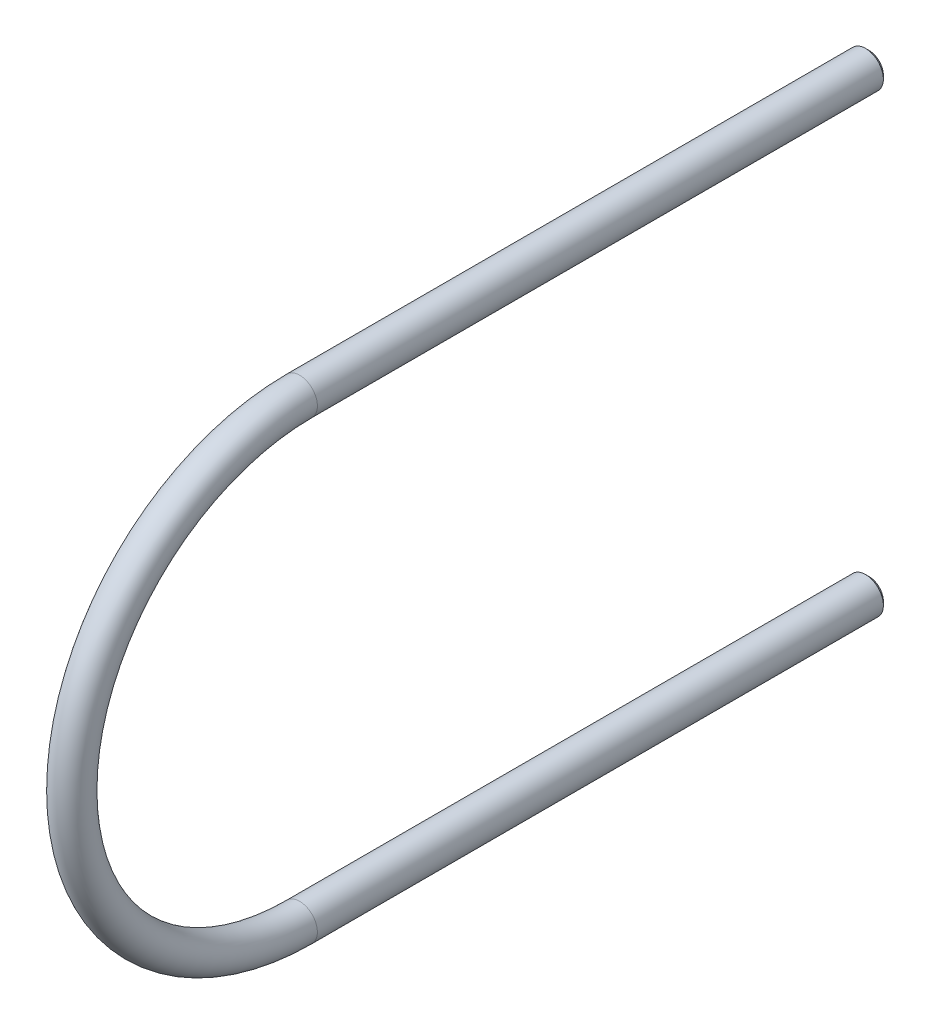
from build123d import *

# Parameters (mm, degrees)
SKETCH1_R           = 2.5
REVOLVE1_ANGLE      = 180
SKETCH1_2_R         = 2.5
BOSS_EXTRUDE1_DEPTH = 80
SKETCH2_R           = 2.5
BOSS_EXTRUDE2_DEPTH = 80
CHAMFER1_SIZE       = 0.5


with BuildPart() as part:
    # Sketch1 → Revolve1 (revolve)
    with BuildSketch(Plane.XY):
        with Locations((0, 32)):
            Circle(SKETCH1_R)
    revolve(axis=Axis((0, 0, 0), (1, 0, 0)), revolution_arc=REVOLVE1_ANGLE)

    # Sketch1<2> → Boss-Extrude1 (add)
    with BuildSketch(Plane.XY):
        with Locations((0, 32)):
            Circle(SKETCH1_2_R)
    extrude(amount=-BOSS_EXTRUDE1_DEPTH)

    # Sketch2 → Boss-Extrude2 (add)
    with BuildSketch(Plane(origin=(0, 0, 0), x_dir=(-1, 0, 0), z_dir=(0, 0, -1))):
        with Locations((0, -32)):
            Circle(SKETCH2_R)
    extrude(amount=BOSS_EXTRUDE2_DEPTH)

    # Chamfer1
    chamfer1_edges = [part.edges().sort_by_distance(p)[0] for p in [
        (2.5, -32, -80),
        (-2.5, 32, -80),
    ]]
    chamfer(chamfer1_edges, length=CHAMFER1_SIZE)


solid = part.part
